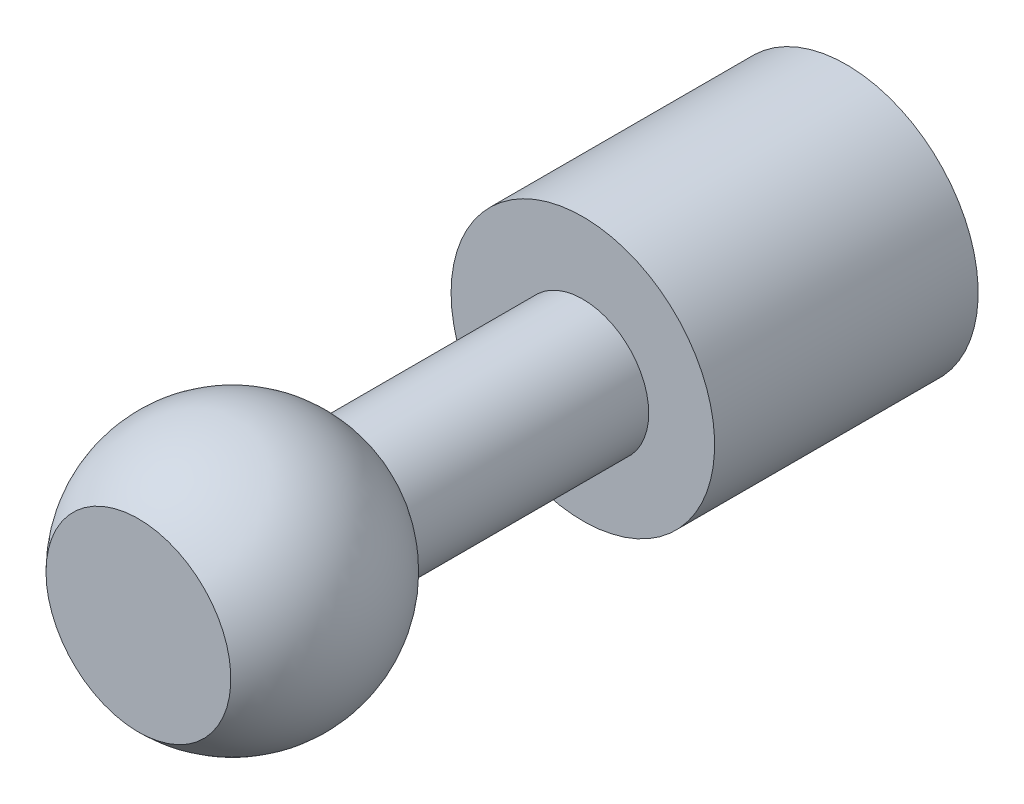
from build123d import *

# Parameters (mm, degrees)
SKETCH1_R               = 2.5
BOSS_EXTRUDE1_DEPTH     = 9.1
CUT_EXTRUDE1_DEPTH      = 20.618613611
CUT_EXTRUDE1_DEPTH_BACK = 20.618613611
SKETCH4_W               = 5.29751814
SKETCH4_H               = 11.035514004
SKETCH5_R               = 5
BOSS_EXTRUDE2_DEPTH     = 10
CUT_EXTRUDE2_DEPTH      = 28.779051493
CUT_EXTRUDE2_DEPTH_BACK = 8
SKETCH6_R               = 4


with BuildPart() as part:
    # Sketch1 → Boss-Extrude1 (new body)
    with BuildSketch(Plane.XY):
        with Locations((0, -0.210420065)):
            Circle(SKETCH1_R)
    extrude(amount=BOSS_EXTRUDE1_DEPTH)

    # Sketch3 → Revolve1 (revolve)
    with BuildSketch(Plane(origin=(0, 0, 0), x_dir=(0, 0, -1), z_dir=(1, 0, 0))):
        with BuildLine():
            Line((-13.3, -5), (-13.3, 5))
            ThreePointArc((-13.3, 5), (-8.3, 0), (-13.3, -5))
        make_face()
    revolve(axis=Axis((0, -5, 13.3), (0, 1, 0)))

    # Sketch4 → Cut-Extrude1 (cut, two sides: drawn at the far end of the back side and taken through both)
    with BuildSketch(Plane(origin=(0, 0, 0), x_dir=(0, 0, -1), z_dir=(1, 0, 0)).offset(-CUT_EXTRUDE1_DEPTH_BACK)):
        with Locations((-19.512781414, 0.215959178)):
            Rectangle(SKETCH4_W, SKETCH4_H)
    extrude(amount=CUT_EXTRUDE1_DEPTH + CUT_EXTRUDE1_DEPTH_BACK, mode=Mode.SUBTRACT)

    # Sketch5 → Boss-Extrude2 (add)
    with BuildSketch(Plane(origin=(0, 0, 0), x_dir=(-1, 0, 0), z_dir=(0, 0, -1))):
        Circle(SKETCH5_R)
    extrude(amount=BOSS_EXTRUDE2_DEPTH)

    # Sketch6 → Cut-Extrude2 (cut, two sides: drawn at the far end of the back side and taken through both)
    with BuildSketch(Plane(origin=(0, 0, -10), x_dir=(-1, 0, 0), z_dir=(0, 0, -1)).offset(-CUT_EXTRUDE2_DEPTH_BACK)):
        with Locations(Location((0, 0, 0), (0, 0, 180))):
            Circle(SKETCH6_R)
    extrude(amount=CUT_EXTRUDE2_DEPTH + CUT_EXTRUDE2_DEPTH_BACK, mode=Mode.SUBTRACT)


solid = part.part
